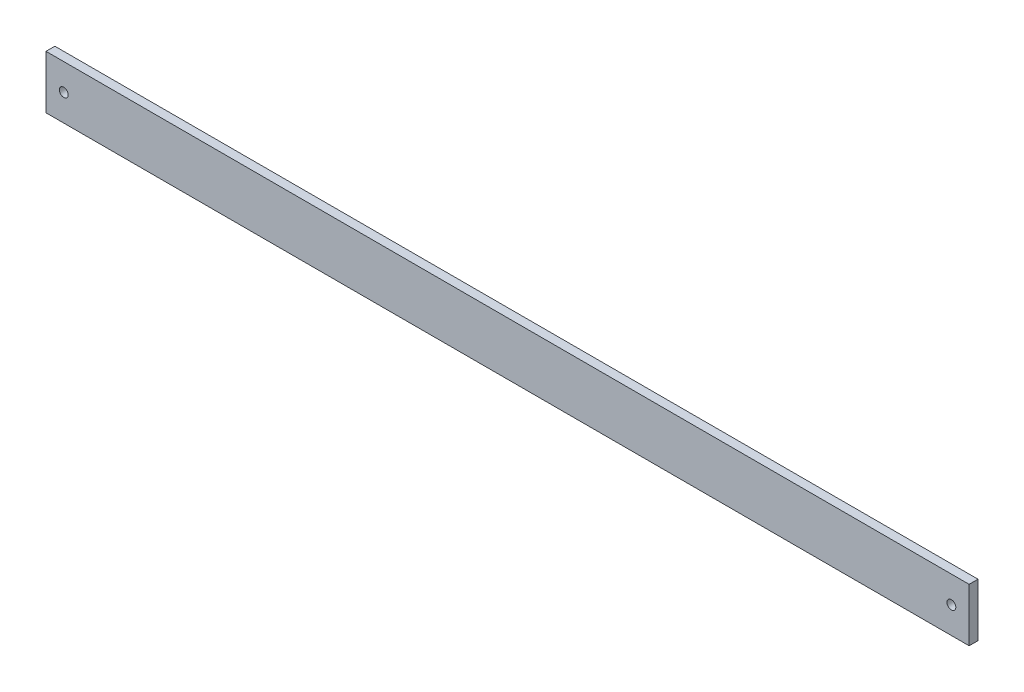
from build123d import *

# Parameters (mm, degrees)
SKETCH7_W           = 330.2
SKETCH7_H           = 19.05
SKETCH7_R           = 1.5875
BOSS_EXTRUDE1_DEPTH = 3.175


with BuildPart() as part:
    # Sketch7 → Boss-Extrude1 (new body)
    with BuildSketch(Plane.XY):
        with Locations((165.1, 9.525)):
            Rectangle(SKETCH7_W, SKETCH7_H)
        with Locations((6.35, 9.525)):
            Circle(SKETCH7_R, mode=Mode.SUBTRACT)
        with Locations((323.85, 9.525)):
            Circle(SKETCH7_R, mode=Mode.SUBTRACT)
    extrude(amount=BOSS_EXTRUDE1_DEPTH)


solid = part.part
